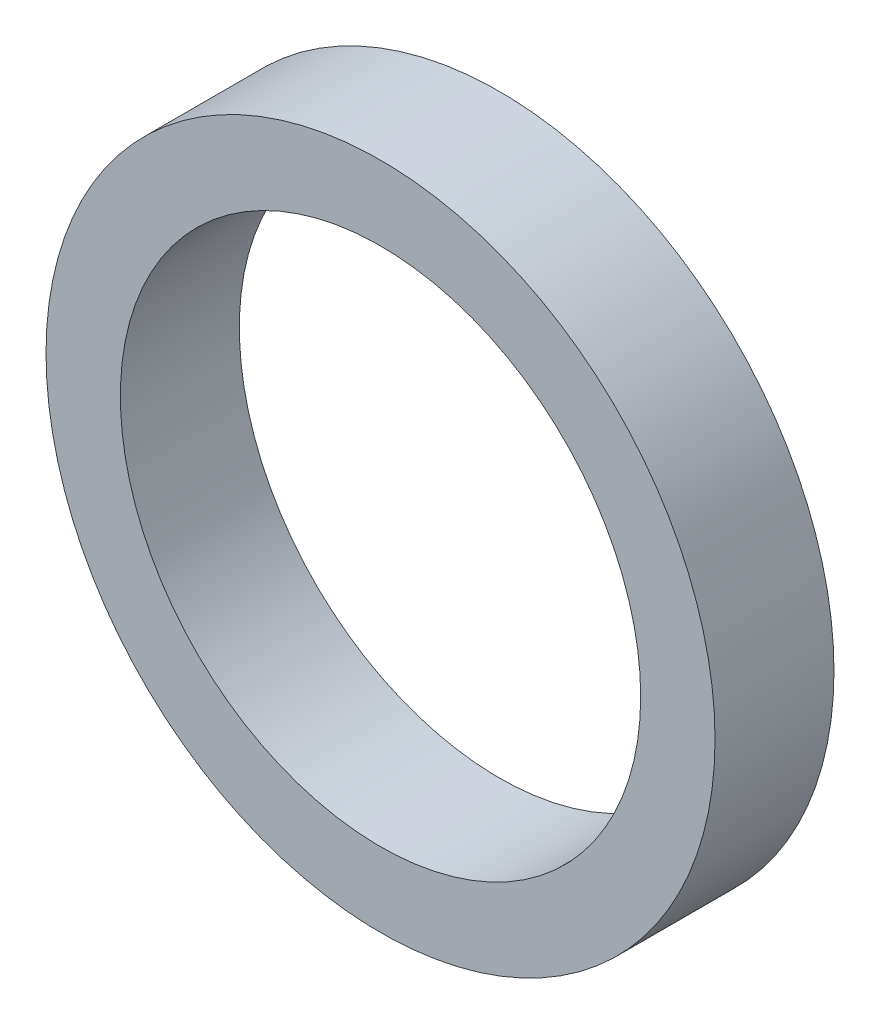
from build123d import *

# Parameters (mm, degrees)
SKETCH1_R           = 7.14375
SKETCH1_R_2         = 5.55625
BOSS_EXTRUDE1_DEPTH = 1.27


with BuildPart() as part:
    # Sketch1 → Boss-Extrude1 (new, symmetric)
    with BuildSketch(Plane.XY):
        Circle(SKETCH1_R)
        Circle(SKETCH1_R_2, mode=Mode.SUBTRACT)
    extrude(amount=BOSS_EXTRUDE1_DEPTH, both=True)


solid = part.part
